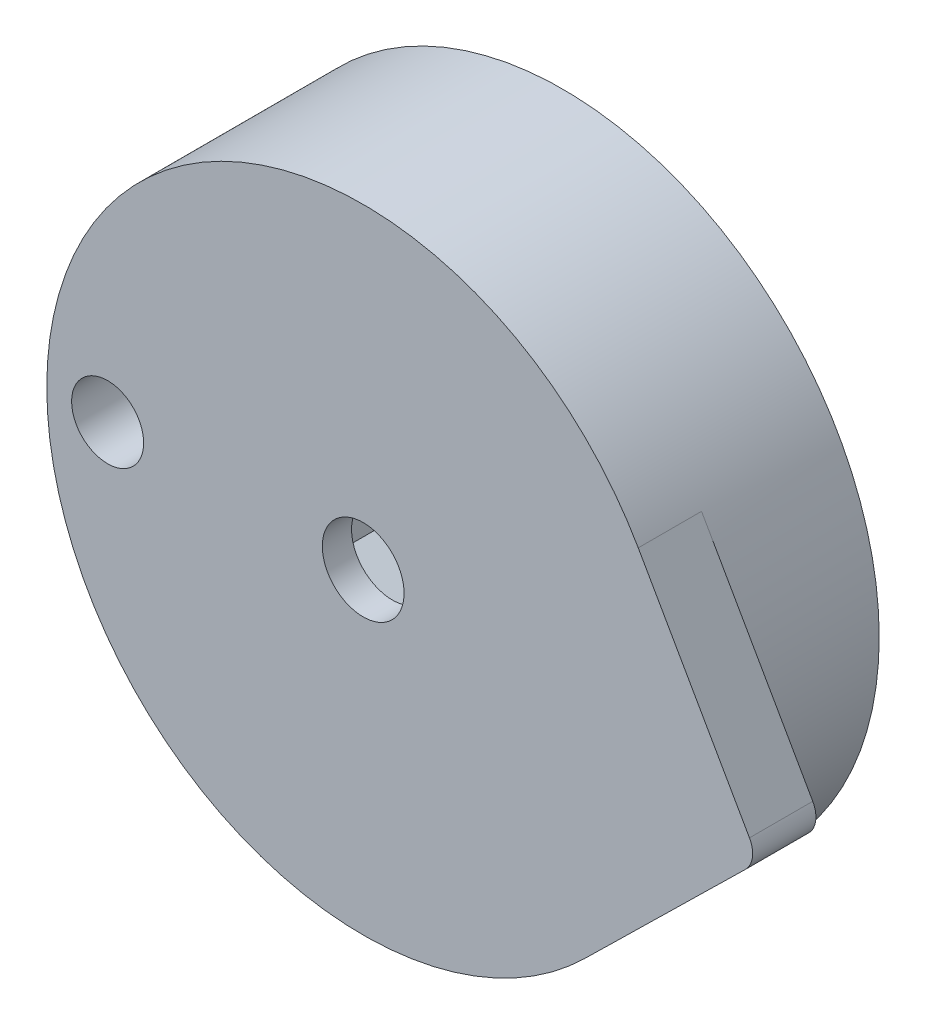
from build123d import *

# Parameters (mm, degrees)
SKETCH2_R               = 32.5
BOSS_EXTRUDE1_DEPTH     = 6
SKETCH3_R               = 32.5
BOSS_EXTRUDE2_DEPTH     = 2
CHAMFER1_SIZE           = 2
CUT_EXTRUDE1_DEPTH      = 6.5
SKETCH5_R               = 4.2
CUT_EXTRUDE2_DEPTH      = 70.12488698
CUT_EXTRUDE3_DEPTH      = 70.079664157
SKETCH8_R               = 15
BOSS_EXTRUDE3_DEPTH     = 3
BOSS_EXTRUDE4_START     = 3
SKETCH9_R               = 4.2
BOSS_EXTRUDE4_DEPTH     = 3
CUT_EXTRUDE5_START      = -3
SKETCH10_R              = 32.5
CUT_EXTRUDE5_DEPTH      = 3
FILLET1_R               = 1.5
SKETCH11_R              = 32.5
BOSS_EXTRUDE5_DEPTH     = 1.5
SKETCH12_R              = 4.2
CUT_EXTRUDE6_DEPTH      = 70.282032303
CHAMFER2_SIZE           = 1
BOSS_EXTRUDE6_DEPTH     = 6.5
BOSS_EXTRUDE8_START     = -6.5
BOSS_EXTRUDE8_DEPTH     = 6.5
BOSS_EXTRUDE10_START    = 14
SKETCH16_R              = 32.5
SKETCH16_R_2            = 20
SKETCH16_R_3            = 3.7
BOSS_EXTRUDE10_DEPTH    = 14
CHAMFER3_SIZE           = 1.5
CUT_EXTRUDE7_DEPTH      = 77.342976101
CUT_EXTRUDE7_DEPTH_BACK = 77.342976101
SKETCH17_R              = 3.7


with BuildPart() as part:
    # Sketch2 → Boss-Extrude1 (new body)
    with BuildSketch(Plane.XY.offset(1)):
        with Locations((23.5, 7.5)):
            Circle(SKETCH2_R)
        with BuildLine():
            Line((-3.5, 0), (-3.5, 15))
            ThreePointArc((-3.5, 15), (0, 18.5), (3.5, 15))
            Line((3.5, 15), (3.5, 0))
            ThreePointArc((3.5, 0), (0, -3.5), (-3.5, 0))
        make_face(mode=Mode.SUBTRACT)
    extrude(amount=BOSS_EXTRUDE1_DEPTH)

    # Sketch3 → Boss-Extrude2 (add)
    with BuildSketch(Plane.XY.offset(7)):
        with Locations((23.5, 7.5)):
            Circle(SKETCH3_R)
    extrude(amount=BOSS_EXTRUDE2_DEPTH)

    # Chamfer1
    chamfer1_edges = [part.edges().sort_by_distance(p)[0] for p in [
        (-3.5, 7.5, 1),
        (0, -3.5, 1),
        (3.5, 7.5, 1),
        (0, 18.5, 1),
    ]]
    chamfer(chamfer1_edges, length=CHAMFER1_SIZE)

    # Sketch4 → Cut-Extrude1 (cut)
    with BuildSketch(Plane(origin=(0, 0, 1), x_dir=(-1, 0, 0), z_dir=(0, 0, -1))):
        Polygon((-23.5, 15.467433715), (-30.4, 11.483716857), (-30.4, 3.516283143), (-23.5, -0.467433715), (-16.6, 3.516283143), (-16.6, 11.483716857), align=None)
    extrude(amount=-CUT_EXTRUDE1_DEPTH, mode=Mode.SUBTRACT)

    # Sketch5 → Cut-Extrude2 (cut, through all)
    with BuildSketch(Plane(origin=(0, 0, 7.5), x_dir=(-1, 0, 0), z_dir=(0, 0, -1))):
        with Locations((-23.5, 7.5)):
            Circle(SKETCH5_R)
    extrude(amount=-CUT_EXTRUDE2_DEPTH, mode=Mode.SUBTRACT)

    # Sketch6 → Cut-Extrude3 (cut, through all)
    with BuildSketch(Plane(origin=(0, 0, 7), x_dir=(-1, 0, 0), z_dir=(0, 0, -1))):
        with BuildLine():
            Line((-3.5, 15), (-3.5, 0))
            ThreePointArc((-3.5, 0), (0, -3.5), (3.5, 0))
            Line((3.5, 0), (3.5, 15))
            ThreePointArc((3.5, 15), (0, 18.5), (-3.5, 15))
        make_face()
    extrude(amount=-CUT_EXTRUDE3_DEPTH, mode=Mode.SUBTRACT)

    # Sketch8 → Boss-Extrude3 (add)
    with BuildSketch(Plane(origin=(0, 0, 1), x_dir=(-1, 0, 0), z_dir=(0, 0, -1))):
        with Locations(Location((-23.5, 7.5, 0), (0, 0, 180))):
            Circle(SKETCH8_R)
        Polygon((-16.6, 3.516283143), (-16.6, 11.483716857), (-23.5, 15.467433715), (-30.4, 11.483716857), (-30.4, 3.516283143), (-23.5, -0.467433715), align=None, mode=Mode.SUBTRACT)
    extrude(amount=BOSS_EXTRUDE3_DEPTH)

    # Sketch9 → Boss-Extrude4 (add)
    with BuildSketch(Plane(origin=(0, 0, 7.5), x_dir=(-1, 0, 0), z_dir=(0, 0, -1)).offset(BOSS_EXTRUDE4_START)):
        Polygon((-16.6, 11.483716857), (-23.5, 15.467433715), (-30.4, 11.483716857), (-30.4, 3.516283143), (-23.5, -0.467433715), (-16.6, 3.516283143), align=None)
        with Locations((-23.5, 7.5)):
            Circle(SKETCH9_R, mode=Mode.SUBTRACT)
    extrude(amount=-BOSS_EXTRUDE4_DEPTH)

    # Sketch10 → Cut-Extrude5 (cut)
    with BuildSketch(Plane.XY.offset(9).offset(CUT_EXTRUDE5_START)):
        with Locations((23.5, 7.5)):
            Circle(SKETCH10_R)
    extrude(amount=CUT_EXTRUDE5_DEPTH, mode=Mode.SUBTRACT)

    # Fillet1
    fillet1_edges = [part.edges().sort_by_distance(p)[0] for p in [
        (8.5, 7.5, -2),
    ]]
    fillet(fillet1_edges, radius=FILLET1_R)

    # Sketch11 → Boss-Extrude5 (add)
    with BuildSketch(Plane.XY.offset(6)):
        with Locations((23.5, 7.5)):
            Circle(SKETCH11_R)
        with BuildLine():
            Line((3.5, 15), (3.5, 0))
            ThreePointArc((3.5, 0), (0, -3.5), (-3.5, 0))
            Line((-3.5, 0), (-3.5, 15))
            ThreePointArc((-3.5, 15), (0, 18.5), (3.5, 15))
        make_face(mode=Mode.SUBTRACT)
    extrude(amount=BOSS_EXTRUDE5_DEPTH)

    # Sketch12 → Cut-Extrude6 (cut, through all)
    with BuildSketch(Plane(origin=(0, 0, 6), x_dir=(-1, 0, 0), z_dir=(0, 0, -1))):
        with Locations((-23.5, 7.5)):
            Circle(SKETCH12_R)
    extrude(amount=-CUT_EXTRUDE6_DEPTH, mode=Mode.SUBTRACT)

    # Chamfer2
    chamfer2_edges = [part.edges().sort_by_distance(p)[0] for p in [
        (20.05, 1.524424714, -2),
        (16.6, 7.5, -2),
        (20.05, 13.475575286, -2),
        (26.95, 13.475575286, -2),
        (30.4, 7.5, -2),
        (26.95, 1.524424714, -2),
    ]]
    chamfer(chamfer2_edges, length=CHAMFER2_SIZE)

    # Sketch13 → Boss-Extrude6 (add)
    with BuildSketch(Plane(origin=(0, 0, 1), x_dir=(-1, 0, 0), z_dir=(0, 0, -1))):
        with BuildLine():
            Line((-51.749638846, 23.568848902), (-63.173049142, 3.4860653))
            ThreePointArc((-63.173049142, 3.4860653), (-63.475854367, 1.903380389), (-62.750057959, 0.464699706))
            Line((-62.750057959, 0.464699706), (-46.250753464, -15.708903826))
            ThreePointArc((-46.250753464, -15.708903826), (-55.686106767, 2.993945053), (-51.749638846, 23.568848902))
        make_face()
    extrude(amount=-BOSS_EXTRUDE6_DEPTH)

    # Sketch15 → Boss-Extrude8 (add)
    with BuildSketch(Plane.XY.offset(7.5).offset(BOSS_EXTRUDE8_START)):
        with BuildLine():
            Line((46.250753464, -15.708903826), (62.750057959, 0.464699706))
            ThreePointArc((62.750057959, 0.464699706), (63.475854367, 1.903380389), (63.173049142, 3.4860653))
            Line((63.173049142, 3.4860653), (51.749638846, 23.568848902))
            ThreePointArc((51.749638846, 23.568848902), (-8.686106767, 12.006054947), (46.250753464, -15.708903826))
        make_face()
        Polygon((23.5, -0.467433715), (16.6, 3.516283143), (16.6, 11.483716857), (23.5, 15.467433715), (30.4, 11.483716857), (30.4, 3.516283143), align=None, mode=Mode.SUBTRACT)
    extrude(amount=BOSS_EXTRUDE8_DEPTH)

    # Sketch16 → Boss-Extrude10 (add)
    with BuildSketch(Plane(origin=(0, 0, 1), x_dir=(-1, 0, 0), z_dir=(0, 0, -1)).offset(BOSS_EXTRUDE10_START)):
        with Locations((-23.5, 7.5)):
            Circle(SKETCH16_R)
        with Locations((-23.5, 7.5)):
            Circle(SKETCH16_R_2, mode=Mode.SUBTRACT)
        with Locations((2.75, 7.5)):
            Circle(SKETCH16_R_3, mode=Mode.SUBTRACT)
    extrude(amount=-BOSS_EXTRUDE10_DEPTH)

    # Chamfer3
    chamfer3_edges = [part.edges().sort_by_distance(p)[0] for p in [
        (0.95, 7.5, -13),
    ]]
    chamfer(chamfer3_edges, length=CHAMFER3_SIZE)

    # Sketch17 → Cut-Extrude7 (cut, two sides: drawn at the far end of the back side and taken through both)
    with BuildSketch(Plane(origin=(0, 0, 1), x_dir=(-1, 0, 0), z_dir=(0, 0, -1)).offset(-CUT_EXTRUDE7_DEPTH_BACK)):
        with Locations((2.75, 7.5)):
            Circle(SKETCH17_R)
    extrude(amount=CUT_EXTRUDE7_DEPTH + CUT_EXTRUDE7_DEPTH_BACK, mode=Mode.SUBTRACT)


solid = part.part
